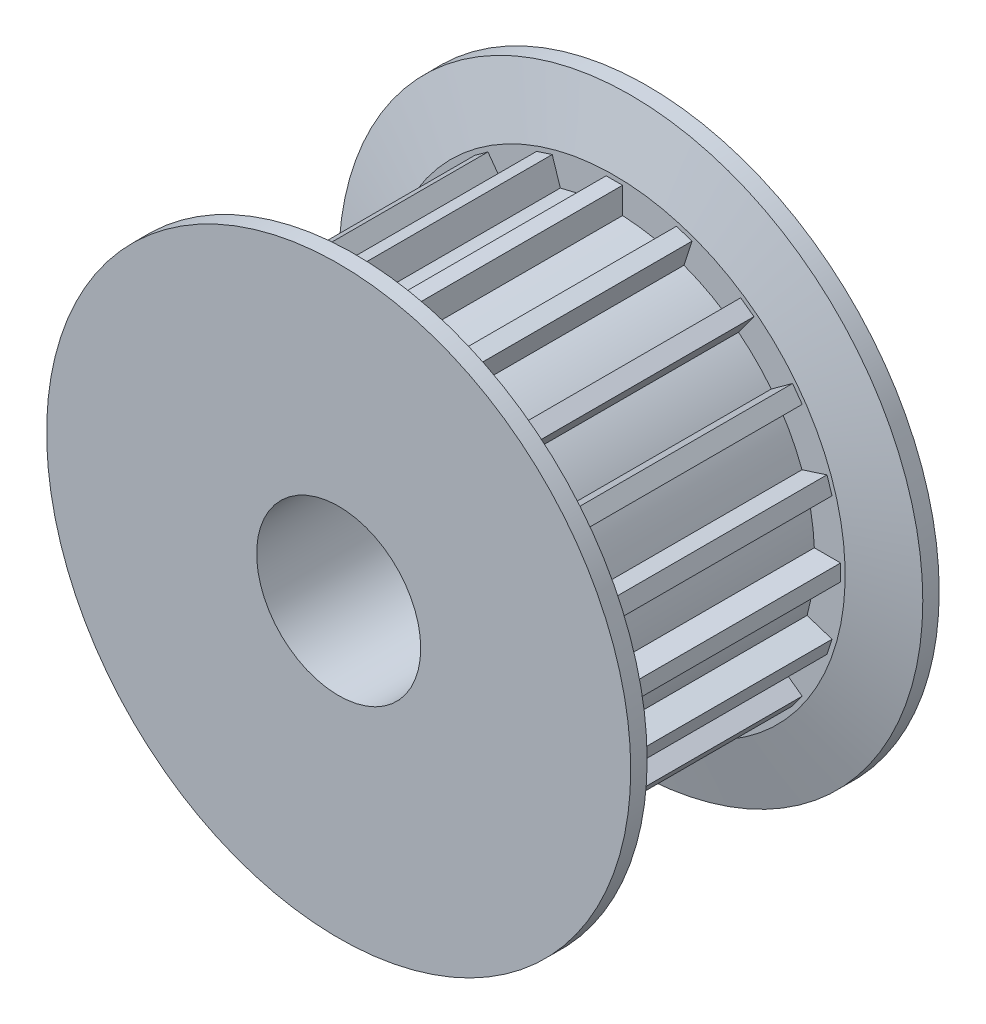
from build123d import *

# Parameters (mm, degrees)
CHAMFER1_SIZE       = 0.5
CHAMFER1_SIZE2      = 1.866025404
CHAMFER2_SIZE       = 0.5
CHAMFER2_SIZE2      = 1.866025404
BOSS_EXTRUDE1_START = 7.4
BOSS_EXTRUDE1_DEPTH = 7.4


with BuildPart() as part:
    # Sketch2 → Revolve1 (revolve)
    with BuildSketch(Plane(origin=(0, 0, 0), x_dir=(0, 0, -1), z_dir=(1, 0, 0)), mode=Mode.PRIVATE) as revolve1_sk:
        Polygon((-16, 2.5), (-6.6, 2.5), (-6.6, 8.9), (-7.6, 8.9), (-7.6, 6.1), (-15, 6.1), (-15, 8.9), (-16, 8.9), align=None)
    revolve(revolve1_sk.sketch.rotate(Axis((0, 0, 79.609460318), (0, 0, -1)), 90), axis=Axis((0, 0, 79.609460318), (0, 0, -1)))

    # Chamfer1
    chamfer1_edges = [part.edges().sort_by_distance(p)[0] for p in [
        (-8.9, 0, 15),
    ]]
    chamfer1_side = [part.faces().sort_by_distance(p)[0] for p in [
        (-8.9, 0, 15.5),
    ]]
    chamfer(chamfer1_edges, length=CHAMFER1_SIZE, length2=CHAMFER1_SIZE2, reference=chamfer1_side[0])

    # Chamfer2
    chamfer2_edges = [part.edges().sort_by_distance(p)[0] for p in [
        (-8.9, 0, 7.6),
    ]]
    chamfer2_side = [part.faces().sort_by_distance(p)[0] for p in [
        (-8.9, 0, 7.1),
    ]]
    chamfer(chamfer2_edges, length=CHAMFER2_SIZE, length2=CHAMFER2_SIZE2, reference=chamfer2_side[0])

    # Sketch4 → Boss-Extrude1 (add)
    with BuildSketch(Plane.XY.offset(7.6).offset(BOSS_EXTRUDE1_START)):
        with BuildLine():
            Line((1.645655792, 5.873824735), (1.892869388, 6.634669948))
            Line((1.892869388, 6.634669948), (2.368397646, 6.48016145))
            Line((2.368397646, 6.48016145), (2.121184051, 5.719316237))
            ThreePointArc((2.121184051, 5.719316237), (1.885003666, 5.801444749), (1.645655792, 5.873824735))
        make_face()
        with BuildLine():
            Line((-0.25, 6.094874896), (-0.25, 6.894874896))
            Line((-0.25, 6.894874896), (0.25, 6.894874896))
            Line((0.25, 6.894874896), (0.25, 6.094874896))
            ThreePointArc((0.25, 6.094874896), (0, 6.1), (-0.25, 6.094874896))
        make_face()
        with BuildLine():
            Line((3.38022333, 5.077803683), (3.850451532, 5.725017278))
            Line((3.850451532, 5.725017278), (4.254960029, 5.431124652))
            Line((4.254960029, 5.431124652), (3.784731827, 4.783911057))
            ThreePointArc((3.784731827, 4.783911057), (3.585490039, 4.935003666), (3.38022333, 5.077803683))
        make_face()
        with BuildLine():
            Line((4.783911057, 3.784731827), (5.431124652, 4.254960029))
            Line((5.431124652, 4.254960029), (5.725017278, 3.850451532))
            Line((5.725017278, 3.850451532), (5.077803683, 3.38022333))
            ThreePointArc((5.077803683, 3.38022333), (4.935003666, 3.585490039), (4.783911057, 3.784731827))
        make_face()
        with BuildLine():
            Line((5.719316237, 2.121184051), (6.48016145, 2.368397646))
            Line((6.48016145, 2.368397646), (6.634669948, 1.892869388))
            Line((6.634669948, 1.892869388), (5.873824735, 1.645655792))
            ThreePointArc((5.873824735, 1.645655792), (5.801444749, 1.885003666), (5.719316237, 2.121184051))
        make_face()
        with BuildLine():
            Line((6.094874896, 0.25), (6.894874896, 0.25))
            Line((6.894874896, 0.25), (6.894874896, -0.25))
            Line((6.894874896, -0.25), (6.094874896, -0.25))
            ThreePointArc((6.094874896, -0.25), (6.1, 0), (6.094874896, 0.25))
        make_face()
        with BuildLine():
            Line((5.873824735, -1.645655792), (6.634669948, -1.892869388))
            Line((6.634669948, -1.892869388), (6.48016145, -2.368397646))
            Line((6.48016145, -2.368397646), (5.719316237, -2.121184051))
            ThreePointArc((5.719316237, -2.121184051), (5.801444749, -1.885003666), (5.873824735, -1.645655792))
        make_face()
        with BuildLine():
            Line((5.077803683, -3.38022333), (5.725017278, -3.850451532))
            Line((5.725017278, -3.850451532), (5.431124652, -4.254960029))
            Line((5.431124652, -4.254960029), (4.783911057, -3.784731827))
            ThreePointArc((4.783911057, -3.784731827), (4.935003666, -3.585490039), (5.077803683, -3.38022333))
        make_face()
        with BuildLine():
            Line((3.784731827, -4.783911057), (4.254960029, -5.431124652))
            Line((4.254960029, -5.431124652), (3.850451532, -5.725017278))
            Line((3.850451532, -5.725017278), (3.38022333, -5.077803683))
            ThreePointArc((3.38022333, -5.077803683), (3.585490039, -4.935003666), (3.784731827, -4.783911057))
        make_face()
        with BuildLine():
            Line((2.121184051, -5.719316237), (2.368397646, -6.48016145))
            Line((2.368397646, -6.48016145), (1.892869388, -6.634669948))
            Line((1.892869388, -6.634669948), (1.645655792, -5.873824735))
            ThreePointArc((1.645655792, -5.873824735), (1.885003666, -5.801444749), (2.121184051, -5.719316237))
        make_face()
        with BuildLine():
            Line((0.25, -6.094874896), (0.25, -6.894874896))
            Line((0.25, -6.894874896), (-0.25, -6.894874896))
            Line((-0.25, -6.894874896), (-0.25, -6.094874896))
            ThreePointArc((-0.25, -6.094874896), (0, -6.1), (0.25, -6.094874896))
        make_face()
        with BuildLine():
            Line((-1.645655792, -5.873824735), (-1.892869388, -6.634669948))
            Line((-1.892869388, -6.634669948), (-2.368397646, -6.48016145))
            Line((-2.368397646, -6.48016145), (-2.121184051, -5.719316237))
            ThreePointArc((-2.121184051, -5.719316237), (-1.885003666, -5.801444749), (-1.645655792, -5.873824735))
        make_face()
        with BuildLine():
            Line((-3.38022333, -5.077803683), (-3.850451532, -5.725017278))
            Line((-3.850451532, -5.725017278), (-4.254960029, -5.431124652))
            Line((-4.254960029, -5.431124652), (-3.784731827, -4.783911057))
            ThreePointArc((-3.784731827, -4.783911057), (-3.585490039, -4.935003666), (-3.38022333, -5.077803683))
        make_face()
        with BuildLine():
            Line((-4.783911057, -3.784731827), (-5.431124652, -4.254960029))
            Line((-5.431124652, -4.254960029), (-5.725017278, -3.850451532))
            Line((-5.725017278, -3.850451532), (-5.077803683, -3.38022333))
            ThreePointArc((-5.077803683, -3.38022333), (-4.935003666, -3.585490039), (-4.783911057, -3.784731827))
        make_face()
        with BuildLine():
            Line((-5.719316237, -2.121184051), (-6.48016145, -2.368397646))
            Line((-6.48016145, -2.368397646), (-6.634669948, -1.892869388))
            Line((-6.634669948, -1.892869388), (-5.873824735, -1.645655792))
            ThreePointArc((-5.873824735, -1.645655792), (-5.801444749, -1.885003666), (-5.719316237, -2.121184051))
        make_face()
        with BuildLine():
            Line((-6.094874896, -0.25), (-6.894874896, -0.25))
            Line((-6.894874896, -0.25), (-6.894874896, 0.25))
            Line((-6.894874896, 0.25), (-6.094874896, 0.25))
            ThreePointArc((-6.094874896, 0.25), (-6.1, 0), (-6.094874896, -0.25))
        make_face()
        with BuildLine():
            Line((-5.873824735, 1.645655792), (-6.634669948, 1.892869388))
            Line((-6.634669948, 1.892869388), (-6.48016145, 2.368397646))
            Line((-6.48016145, 2.368397646), (-5.719316237, 2.121184051))
            ThreePointArc((-5.719316237, 2.121184051), (-5.801444749, 1.885003666), (-5.873824735, 1.645655792))
        make_face()
        with BuildLine():
            Line((-5.077803683, 3.38022333), (-5.725017278, 3.850451532))
            Line((-5.725017278, 3.850451532), (-5.431124652, 4.254960029))
            Line((-5.431124652, 4.254960029), (-4.783911057, 3.784731827))
            ThreePointArc((-4.783911057, 3.784731827), (-4.935003666, 3.585490039), (-5.077803683, 3.38022333))
        make_face()
        with BuildLine():
            Line((-3.784731827, 4.783911057), (-4.254960029, 5.431124652))
            Line((-4.254960029, 5.431124652), (-3.850451532, 5.725017278))
            Line((-3.850451532, 5.725017278), (-3.38022333, 5.077803683))
            ThreePointArc((-3.38022333, 5.077803683), (-3.585490039, 4.935003666), (-3.784731827, 4.783911057))
        make_face()
        with BuildLine():
            Line((-2.121184051, 5.719316237), (-2.368397646, 6.48016145))
            Line((-2.368397646, 6.48016145), (-1.892869388, 6.634669948))
            Line((-1.892869388, 6.634669948), (-1.645655792, 5.873824735))
            ThreePointArc((-1.645655792, 5.873824735), (-1.885003666, 5.801444749), (-2.121184051, 5.719316237))
        make_face()
    extrude(amount=-BOSS_EXTRUDE1_DEPTH)


solid = part.part
